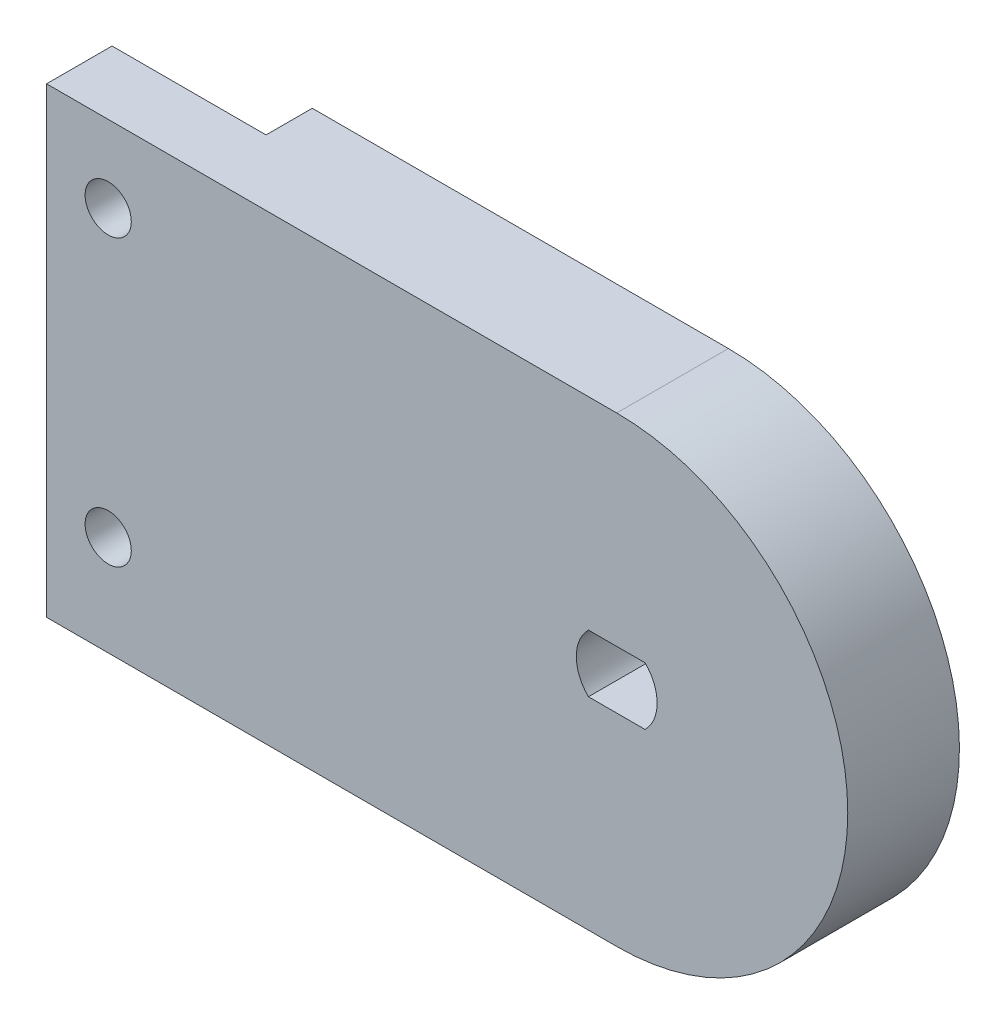
from build123d import *

# Parameters (mm, degrees)
BOSS_EXTRUDE1_DEPTH     = 8
BOSS_EXTRUDE2_DEPTH     = 8
SKETCH4_W               = 36.000000000000064
SKETCH4_H               = 30.000000000000057
BOSS_EXTRUDE3_DEPTH     = 8
SKETCH5_R               = 7.000000000000002
SKETCH5_R_2             = 5.000000000000002
BOSS_EXTRUDE4_DEPTH     = 10
CHAMFER1_SIZE           = 3
CUT_EXTRUDE1_REACH      = 260.278
CUT_EXTRUDE2_DEPTH      = 254.2099380250209
SKETCH8_W               = 17.000000000000007
SKETCH8_H               = 20.000000000000043
BOSS_EXTRUDE5_DEPTH     = 7
CUT_EXTRUDE3_DEPTH      = 0.75
CUT_EXTRUDE4_DEPTH      = 0.75
CUT_EXTRUDE5_DEPTH      = 254.2099381566107
CUT_EXTRUDE5_DEPTH_BACK = 254.2099381566107
CUT_EXTRUDE6_DEPTH      = 3
SKETCH14_W              = 9.999999998633207
SKETCH14_H              = 30.000000000000057
CUT_EXTRUDE7_DEPTH      = 3
CUT_EXTRUDE8_START      = -33
CUT_EXTRUDE8_DEPTH      = 30
SKETCH16_W              = 67.2347482813901
SKETCH16_H              = 36.897117956044724
CUT_EXTRUDE9_DEPTH      = 28.75


with BuildPart() as part:
    # Sketch2 → Boss-Extrude1 (new body)
    with BuildSketch(Plane.XY.offset(-8.000000000000261)):
        with BuildLine():
            Line((-25.76918534335193, 245.18029985394168), (-54.787386755608914, 245.18029985394168))
            Line((-54.787386755608914, 245.18029985394168), (-54.787386755608914, 215.18029985394165))
            Line((-54.787386755608914, 215.18029985394165), (-25.76918534335193, 215.18029985394165))
            ThreePointArc((-25.76918534335193, 215.18029985394165), (-10.7691853433519, 230.18029985394168), (-25.76918534335193, 245.18029985394168))
        make_face()
    extrude(amount=BOSS_EXTRUDE1_DEPTH)



with BuildPart() as body_2:
    # Sketch3 → Boss-Extrude2 (new body)
    with BuildSketch(Plane(origin=(4.616e-14, 1.89e-15, -28.000000000000256), x_dir=(-1, 0, -1.65e-15), z_dir=(1.65e-15, 7e-17, -1))):
        with BuildLine():
            Line((25.769185343351936, 215.18029985394165), (54.78738675560893, 215.18029985394165))
            Line((54.78738675560893, 215.18029985394165), (54.78738675560893, 245.18029985394168))
            Line((54.78738675560893, 245.18029985394168), (25.76918534335194, 245.18029985394168))
            ThreePointArc((25.76918534335194, 245.18029985394168), (10.769185343351939, 230.18029985394168), (25.769185343351936, 215.18029985394165))
        make_face()
    extrude(amount=BOSS_EXTRUDE2_DEPTH)


with BuildPart() as part_1:
    add(part.part)

    add(body_2.part)  # Boss-Extrude3 merges body 2
    # Sketch4 → Boss-Extrude3 (add)
    with BuildSketch(Plane.ZY.offset(54.787386755608914)):
        with Locations((-18.000000000000345, 230.18029985394168)):
            Rectangle(SKETCH4_W, SKETCH4_H)
    extrude(amount=BOSS_EXTRUDE3_DEPTH)

    # Sketch5 → Boss-Extrude4 (add)
    with BuildSketch(Plane.ZY.offset(62.78738675560891)):
        with Locations((-18.00000000000032, 230.18029985394168)):
            Circle(SKETCH5_R)
        with Locations((-18.00000000000032, 230.18029985394168)):
            Circle(SKETCH5_R_2, mode=Mode.SUBTRACT)
    extrude(amount=BOSS_EXTRUDE4_DEPTH)

    # Chamfer1
    chamfer1_edges = [part_1.edges().sort_by_distance(p)[0] for p in [
        (-62.78738675560891, 230.18029985394168, -25.00000000000032),
    ]]
    chamfer(chamfer1_edges, length=CHAMFER1_SIZE)

    # Cut-Extrude1: up to this face of the body (flat: up to its plane)
    cut_extrude1_end = Plane(part_1.part.faces().sort_by_distance((-38.272954764, 230.180299854, 0))[0])
    # Sketch6 → Cut-Extrude1 (cut, up to the picked face)
    with BuildSketch(Plane(origin=(0, 0, -36.00000000000038), x_dir=(-1, 0, 0), z_dir=(0, 0, -1)), mode=Mode.PRIVATE) as cut_extrude1_sk1:
        with BuildLine():
            Line((23.93206803626449, 232.05529985394165), (27.606302650439275, 232.05529985394165))
            ThreePointArc((27.606302650439275, 232.05529985394165), (28.39418534335189, 230.18029985394165), (27.606302650439247, 228.30529985394165))
            Line((27.606302650439247, 228.30529985394165), (23.932068036264518, 228.30529985394165))
            ThreePointArc((23.932068036264518, 228.30529985394165), (23.144185343351896, 230.18029985394165), (23.93206803626449, 232.05529985394165))
        make_face()
    cut_extrude1_tool1 = split(extrude(cut_extrude1_sk1.sketch, amount=-CUT_EXTRUDE1_REACH, mode=Mode.PRIVATE), bisect_by=cut_extrude1_end, keep=Keep.BOTH, mode=Mode.PRIVATE)
    add(cut_extrude1_tool1.solids().sort_by(Axis((-25.769185, 230.1803, -36), (0, 0, 1)))[0], mode=Mode.SUBTRACT)

    # Sketch7 → Cut-Extrude2 (cut, through all)
    with BuildSketch(Plane.ZY.offset(62.78738675560891)):
        with BuildLine():
            Line((-3.1052e-13, 215.18029985394165), (-3.1052e-13, 218.18029985394165))
            ThreePointArc((-3.1052e-13, 218.18029985394165), (-0.878679656440668, 216.05897951038202), (-3.0000000000003104, 215.18029985394165))
            Line((-3.0000000000003104, 215.18029985394165), (-3.1052e-13, 215.18029985394165))
        make_face()
        with BuildLine():
            Line((-36.000000000000384, 215.18029985394165), (-33.00000000000038, 215.18029985394165))
            ThreePointArc((-33.00000000000038, 215.18029985394165), (-35.12132034356002, 216.058979510382), (-36.000000000000384, 218.18029985394165))
            Line((-36.000000000000384, 218.18029985394165), (-36.000000000000384, 215.18029985394165))
        make_face()
    extrude(amount=-CUT_EXTRUDE2_DEPTH, mode=Mode.SUBTRACT)

    # Sketch8 → Boss-Extrude5 (add)
    with BuildSketch(Plane.XZ.offset(-215.18029985394165)):
        with Locations((-48.28738675560892, -18.000000000000284)):
            Rectangle(SKETCH8_W, SKETCH8_H)
    extrude(amount=-BOSS_EXTRUDE5_DEPTH)

    # Sketch10 → Cut-Extrude3 (cut)
    with BuildSketch(Plane.XY.offset(-28.000000000000256)):
        with BuildLine():
            Line((-54.78738675560893, 222.18029985394168), (-39.78738675560896, 222.18029985394168))
            Line((-39.78738675560896, 222.18029985394168), (-39.78738675560896, 215.18029985394165))
            Line((-39.78738675560896, 215.18029985394165), (-25.769185343351936, 215.18029985394165))
            ThreePointArc((-25.769185343351936, 215.18029985394165), (-10.76918534335191, 230.18029985394168), (-25.76918534335194, 245.18029985394168))
            Line((-25.76918534335194, 245.18029985394168), (-54.78738675560893, 245.18029985394168))
            Line((-54.78738675560893, 245.18029985394168), (-54.78738675560893, 222.18029985394168))
        make_face()
    extrude(amount=-CUT_EXTRUDE3_DEPTH, mode=Mode.SUBTRACT)

    # Sketch11 → Cut-Extrude4 (cut)
    with BuildSketch(Plane(origin=(0, 0, -8.000000000000261), x_dir=(-1, 0, 0), z_dir=(0, 0, -1))):
        with BuildLine():
            Line((25.76918534335193, 215.18029985394165), (39.787386755608914, 215.18029985394165))
            Line((39.787386755608914, 215.18029985394165), (39.787386755608914, 222.18029985394168))
            Line((39.787386755608914, 222.18029985394168), (54.787386755608914, 222.18029985394168))
            Line((54.787386755608914, 222.18029985394168), (54.787386755608914, 245.18029985394168))
            Line((54.787386755608914, 245.18029985394168), (25.76918534335193, 245.18029985394168))
            ThreePointArc((25.76918534335193, 245.18029985394168), (10.769185343351928, 230.18029985394168), (25.76918534335193, 215.18029985394165))
        make_face()
    extrude(amount=-CUT_EXTRUDE4_DEPTH, mode=Mode.SUBTRACT)

    # Sketch12 → Cut-Extrude5 (cut, two sides: drawn at the far end of the back side and taken through both)
    with BuildSketch(Plane.ZY.offset(62.78738675560891).offset(-CUT_EXTRUDE5_DEPTH_BACK)):
        with BuildLine():
            Line((-23.750000000000245, 242.68029985394168), (-12.25000000000027, 242.68029985394168))
            ThreePointArc((-12.25000000000027, 242.68029985394168), (-11.542893218813717, 242.38740663512823), (-11.250000000000261, 241.68029985394168))
            Line((-11.250000000000261, 241.68029985394168), (-11.250000000000261, 239.18029985394168))
            ThreePointArc((-11.250000000000261, 239.18029985394168), (-11.542893218813717, 238.47319307275512), (-12.25000000000027, 238.18029985394168))
            Line((-12.25000000000027, 238.18029985394168), (-23.750000000000245, 238.18029985394168))
            ThreePointArc((-23.750000000000245, 238.18029985394168), (-24.4571067811868, 238.47319307275512), (-24.750000000000256, 239.18029985394168))
            Line((-24.750000000000256, 239.18029985394168), (-24.750000000000256, 241.68029985394168))
            ThreePointArc((-24.750000000000256, 241.68029985394168), (-24.4571067811868, 242.38740663512823), (-23.750000000000245, 242.68029985394168))
        make_face()
    extrude(amount=CUT_EXTRUDE5_DEPTH + CUT_EXTRUDE5_DEPTH_BACK, mode=Mode.SUBTRACT)

    # Sketch13 → Cut-Extrude6 (cut)
    with BuildSketch(Plane(origin=(0, 0, -36.00000000000038), x_dir=(-1, 0, 0), z_dir=(0, 0, -1))):
        Polygon((52.78738675697571, 245.1803259806636), (65.22032452313796, 245.1803259806636), (65.22032452313796, 215.18029985394165), (52.787386756975714, 215.18029985394165), align=None)
    extrude(amount=-CUT_EXTRUDE6_DEPTH, mode=Mode.SUBTRACT)

    # Sketch14 → Cut-Extrude7 (cut)
    with BuildSketch(Plane.XY):
        with Locations((-57.78738675629231, 230.18029985394168)):
            Rectangle(SKETCH14_W, SKETCH14_H)
    extrude(amount=-CUT_EXTRUDE7_DEPTH, mode=Mode.SUBTRACT)

    # Sketch15 → Cut-Extrude8 (cut)
    with BuildSketch(Plane.XY.offset(CUT_EXTRUDE8_START)):
        with BuildLine():
            add(Edge.make_bspline(
                [(-58.787343120375006, 241.68025514760154), (-61.78734312026629, 241.68025514726713), (-61.78734312015468, 238.68025514738127), (-58.7873431202634, 238.68025514771568), (-55.78734312037213, 238.6802551480501), (-55.78734312048373, 241.68025514793592), (-58.787343120375006, 241.68025514760154)],
                knots=[0, 0, 0, 0, 0.5, 0.5, 0.5, 1, 1, 1, 1], degree=3, weights=[1, 0.33333333333333337, 0.33333333333333337, 1, 0.33333333333333337, 0.33333333333333337, 1]))
        make_face()
        with BuildLine():
            add(Edge.make_bspline(
                [(-58.787343119686746, 223.17998583120436), (-61.78734311957803, 223.17998583086998), (-61.78734311946642, 220.17998583098415), (-58.787343119575134, 220.1799858313185), (-55.78734311968384, 220.1799858316529), (-55.78734311979546, 223.17998583153874), (-58.787343119686746, 223.17998583120436)],
                knots=[0, 0, 0, 0, 0.5, 0.5, 0.5, 1, 1, 1, 1], degree=3, weights=[1, 0.33333333333333337, 0.33333333333333337, 1, 0.33333333333333337, 0.33333333333333337, 1]))
        make_face()
    extrude(amount=CUT_EXTRUDE8_DEPTH, mode=Mode.SUBTRACT)

    # Sketch16 → Cut-Extrude9 (cut)
    with BuildSketch(Plane.XY):
        with Locations((-42.47434442630761, 229.60312045940518)):
            Rectangle(SKETCH16_W, SKETCH16_H)
    extrude(amount=-CUT_EXTRUDE9_DEPTH, mode=Mode.SUBTRACT)


solid = part_1.part
